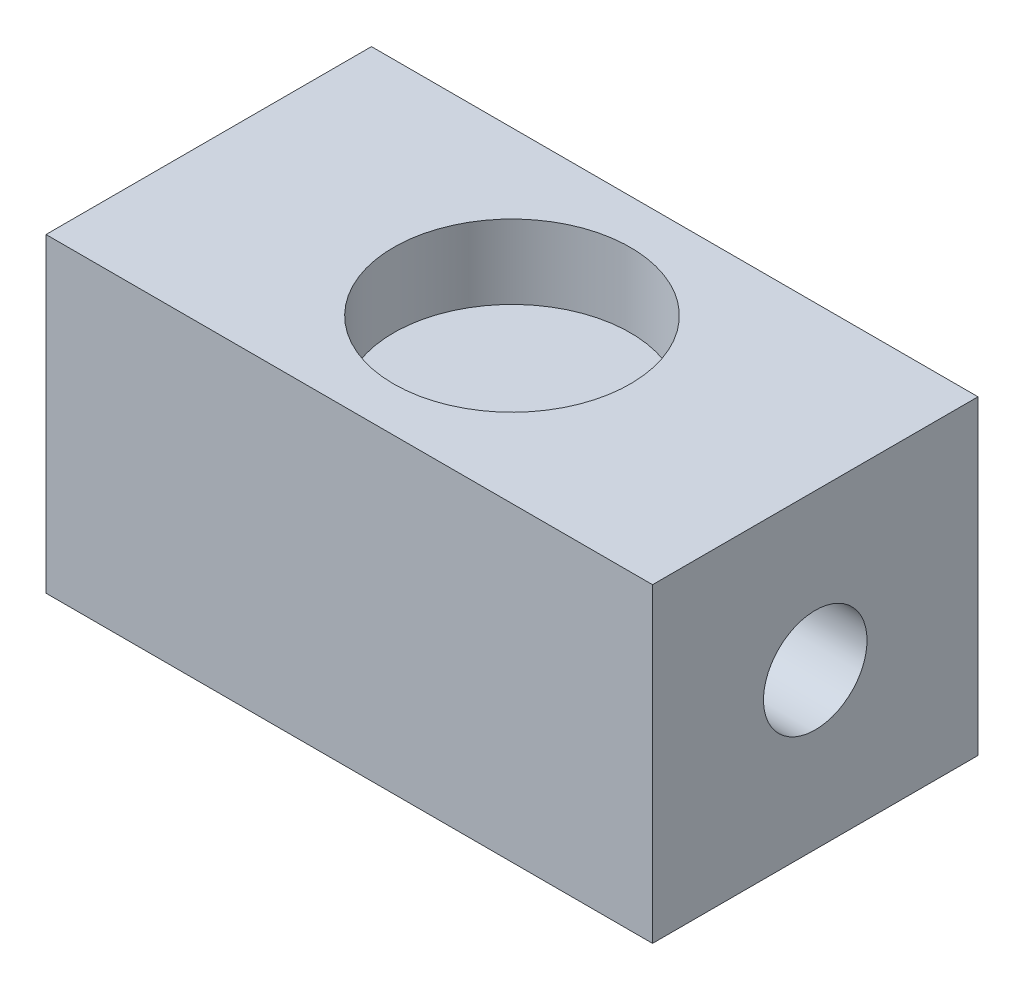
from build123d import *

# Parameters (mm, degrees)
SKETCH1_W           = 55.88
SKETCH1_H           = 53.34
BOSS_EXTRUDE1_DEPTH = 104.14
SKETCH2_R           = 8.89
CUT_EXTRUDE1_DEPTH  = 112.072373253
SKETCH3_R           = 20.32
CUT_EXTRUDE2_DEPTH  = 12.7


with BuildPart() as part:
    # Sketch1 → Boss-Extrude1 (new body)
    with BuildSketch(Plane(origin=(0, 0, 0), x_dir=(0, 0, -1), z_dir=(1, 0, 0))):
        Rectangle(SKETCH1_W, SKETCH1_H)
    extrude(amount=BOSS_EXTRUDE1_DEPTH)

    # Sketch2 → Cut-Extrude1 (cut, through all)
    with BuildSketch(Plane(origin=(104.14, 0, 0), x_dir=(0, 0, -1), z_dir=(1, 0, 0))):
        Circle(SKETCH2_R)
    extrude(amount=-CUT_EXTRUDE1_DEPTH, mode=Mode.SUBTRACT)

    # Sketch3 → Cut-Extrude2 (cut)
    with BuildSketch(Plane(origin=(0, 26.67, 0), x_dir=(1, 0, 0), z_dir=(0, 1, 0))):
        with Locations(Location((52.07, 0, 0), (0, 0, 270))):
            Circle(SKETCH3_R)
    extrude(amount=-CUT_EXTRUDE2_DEPTH, mode=Mode.SUBTRACT)


solid = part.part
